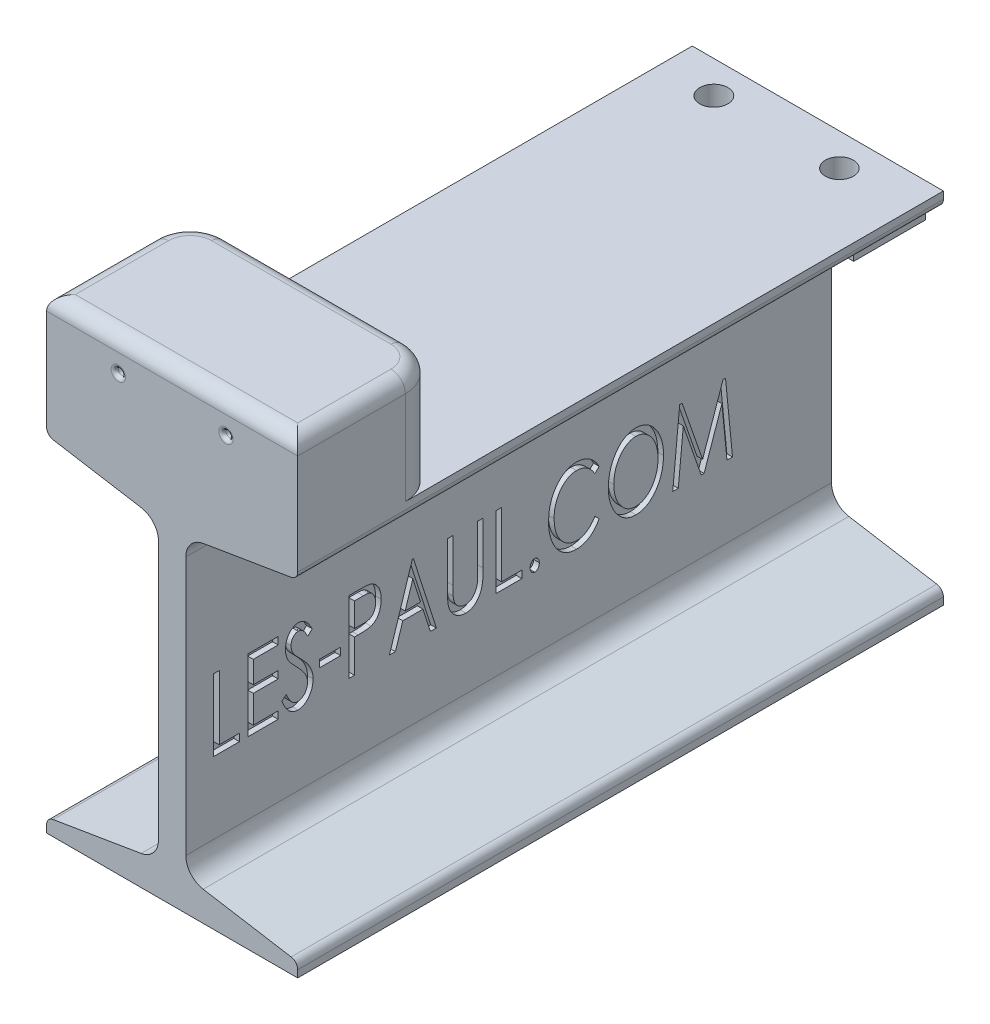
from build123d import *

# Parameters (mm, degrees)
BOSS_EXTRUDE1_DEPTH = 114.3
SKETCH2_W           = 88.9
SKETCH2_H           = 50.8
BOSS_EXTRUDE2_DEPTH = 38.1
FILLET4_R           = 12.7
FILLET5_R           = 5.08
SKETCH42_R          = 1.27
CUT_EXTRUDE3_DEPTH  = 88.9
FILLET8_R           = 1.27
SKETCH45_W          = 76.2
SKETCH45_H          = 25.4
BOSS_EXTRUDE3_DEPTH = 12.065
SKETCH47_R          = 5
CUT_EXTRUDE5_DEPTH  = 12.065
SKETCH47_4_R        = 5
SKETCH47_4_R_2      = 4.953
CUT_EXTRUDE9_DEPTH  = 25.4
SKETCH51_W          = 7.48974359
SKETCH51_H          = 2.605128205
CUT_EXTRUDE8_DEPTH  = 2
SKETCH52_R          = 1.905
CUT_EXTRUDE10_DEPTH = 8.89
SKETCH53_R          = 1.905
CUT_EXTRUDE11_DEPTH = 8.89


with BuildPart() as part:
    # Sketch1 → Boss-Extrude1 (new, symmetric)
    with BuildSketch(Plane.XY):
        with BuildLine():
            Line((-44.45, 63.5), (44.45, 63.5))
            Line((44.45, 63.5), (44.45, 60.96))
            ThreePointArc((44.45, 60.96), (43.787841232, 59.153985338), (42.11521907, 58.203996762))
            Line((42.11521907, 58.203996762), (10.981331544, 53.016312413))
            ThreePointArc((10.981331544, 53.016312413), (6.571691296, 50.511797077), (4.826, 45.750485695))
            Line((4.826, 45.750485695), (4.826, -45.750485695))
            ThreePointArc((4.826, -45.750485695), (6.571691296, -50.511797077), (10.981331544, -53.016312413))
            Line((10.981331544, -53.016312413), (42.11521907, -58.203996762))
            ThreePointArc((42.11521907, -58.203996762), (43.787841232, -59.153985338), (44.45, -60.96))
            Line((44.45, -60.96), (44.45, -63.5))
            Line((44.45, -63.5), (-44.45, -63.5))
            Line((-44.45, -63.5), (-44.45, -60.96))
            ThreePointArc((-44.45, -60.96), (-43.787841232, -59.153985338), (-42.11521907, -58.203996762))
            Line((-42.11521907, -58.203996762), (-10.981331544, -53.016312413))
            ThreePointArc((-10.981331544, -53.016312413), (-6.571691296, -50.511797077), (-4.826, -45.750485695))
            Line((-4.826, -45.750485695), (-4.826, 45.750485695))
            ThreePointArc((-4.826, 45.750485695), (-6.571691296, 50.511797077), (-10.981331544, 53.016312413))
            Line((-10.981331544, 53.016312413), (-42.11521907, 58.203996762))
            ThreePointArc((-42.11521907, 58.203996762), (-43.787841232, 59.153985338), (-44.45, 60.96))
            Line((-44.45, 60.96), (-44.45, 63.5))
        make_face()
    extrude(amount=BOSS_EXTRUDE1_DEPTH, both=True)

    # Sketch2 → Boss-Extrude2 (add)
    with BuildSketch(Plane(origin=(0, 63.5, 0), x_dir=(1, 0, 0), z_dir=(0, 1, 0))):
        with Locations((0, -88.9)):
            Rectangle(SKETCH2_W, SKETCH2_H)
    extrude(amount=BOSS_EXTRUDE2_DEPTH)

    # Fillet4
    fillet4_edges = [part.edges().sort_by_distance(p)[0] for p in [
        (44.45, 82.55, 63.5),
        (-44.45, 82.55, 63.5),
    ]]
    fillet(fillet4_edges, radius=FILLET4_R)

    # Fillet5
    fillet5_edges = [part.edges().sort_by_distance(p)[0] for p in [
        (0, 101.6, 114.3),
        (44.45, 101.6, 95.25),
        (-44.45, 101.6, 95.25),
        (0, 101.6, 63.5),
        (40.730256121, 101.6, 67.219743879),
        (-40.730256121, 101.6, 67.219743879),
    ]]
    fillet(fillet5_edges, radius=FILLET5_R)

    # Sketch42 → Cut-Extrude3 (cut, symmetric)
    with BuildSketch(Plane(origin=(0, 141.271299333, 63.5), x_dir=(-1, 0, 0), z_dir=(0, 0, 1))):
        with Locations(Location((19.05, 51.101299333, 0), (0, 0, 180))):
            Circle(SKETCH42_R)
        with Locations(Location((-19.05, 51.101299333, 0), (0, 0, 180))):
            Circle(SKETCH42_R)
    extrude(amount=CUT_EXTRUDE3_DEPTH, both=True, mode=Mode.SUBTRACT)

    # Fillet8
    fillet8_edges = [part.edges().sort_by_distance(p)[0] for p in [
        (-20.32, 90.17, 114.3),
        (17.78, 90.17, 114.3),
    ]]
    fillet(fillet8_edges, radius=FILLET8_R)

    # Sketch45 → Boss-Extrude3 (add)
    with BuildSketch(Plane(origin=(0, 63.5, 0), x_dir=(1, 0, 0), z_dir=(0, 1, 0))):
        with Locations((0, 101.6)):
            Rectangle(SKETCH45_W, SKETCH45_H)
    extrude(amount=-BOSS_EXTRUDE3_DEPTH)

    # Sketch47 → Cut-Extrude5 (cut)
    with BuildSketch(Plane(origin=(0, 63.5, 0), x_dir=(1, 0, 0), z_dir=(0, 1, 0))):
        with Locations(Location((-25.4, 102.87, 0), (0, 0, 270))):
            Circle(SKETCH47_R)
    extrude(amount=-CUT_EXTRUDE5_DEPTH, mode=Mode.SUBTRACT)

    # Sketch47<4> → Cut-Extrude9 (cut)
    with BuildSketch(Plane(origin=(0, 63.5, 0), x_dir=(1, 0, 0), z_dir=(0, 1, 0))):
        with Locations(Location((-25.4, 102.87, 0), (0, 0, 270))):
            Circle(SKETCH47_4_R)
        with Locations(Location((19.05, 102.87, 0), (0, 0, 270))):
            Circle(SKETCH47_4_R_2)
    extrude(amount=-CUT_EXTRUDE9_DEPTH, mode=Mode.SUBTRACT)

    # Sketch51 → Cut-Extrude8 (cut)
    # profile 1 of 12: a face of its own
    with BuildSketch(Plane(origin=(4.826, 0, 0), x_dir=(0, 0, -1), z_dir=(1, 0, 0))):
        Polygon((-104.400512821, 5.049514305), (-102.446666667, 5.049514305), (-102.446666667, -17.74535749), (-95.282564103, -17.74535749), (-95.282564103, -20.350485695), (-104.400512821, -20.350485695), align=None)
    # profile 2 of 12: a face of its own
    with BuildSketch(Plane(origin=(4.826, 0, 0), x_dir=(0, 0, -1), z_dir=(1, 0, 0))):
        Polygon((-92.351794872, 5.049514305), (-81.605641026, 5.049514305), (-81.605641026, 2.444386099), (-90.397948718, 2.444386099), (-90.397948718, -5.370998516), (-81.605641026, -5.370998516), (-81.605641026, -7.976126721), (-90.397948718, -7.976126721), (-90.397948718, -17.74535749), (-81.605641026, -17.74535749), (-81.605641026, -20.350485695), (-92.351794872, -20.350485695), align=None)
    # profile 3 of 12: a face of its own
    with BuildSketch(Plane(origin=(4.826, 0, 0), x_dir=(0, 0, -1), z_dir=(1, 0, 0))):
        with BuildLine():
            Line((-80.303076923, -15.450605888), (-78.715576923, -14.163306208))
            add(Edge.make_bspline(
                [(-78.715576923, -14.163306208), (-78.574883617, -14.496433349), (-78.307790261, -15.128844713), (-77.848672791, -15.991031141), (-77.378359146, -16.725351333), (-76.890233935, -17.328288444), (-76.384195686, -17.804340451), (-75.85371575, -18.142323844), (-75.302010403, -18.357564561), (-74.923304676, -18.383738902), (-74.736650641, -18.396639542)],
                knots=[0, 0, 0, 0, 1.414329296, 2.684974627, 3.816993744, 4.82134896, 5.71371991, 6.521980361, 7.271523217, 8, 8, 8, 8], degree=3))
            add(Edge.make_bspline(
                [(-74.736650641, -18.396639542), (-74.576468371, -18.390537748), (-74.258840481, -18.378438407), (-73.793054903, -18.257490271), (-73.340345311, -18.0751798), (-72.912086788, -17.812424708), (-72.508521276, -17.497580365), (-72.163797993, -17.113149287), (-71.857485983, -16.690314469), (-71.617890012, -16.213746414), (-71.424733171, -15.708929022), (-71.290284342, -15.182736725), (-71.196220604, -14.643254704), (-71.188856966, -14.277354762), (-71.185128205, -14.092072234)],
                knots=[0, 0, 0, 0, 0.928606423, 1.841347975, 2.778019208, 3.754562154, 4.750003874, 5.740068751, 6.74327989, 7.774305638, 8.828187407, 9.877177034, 10.925055835, 12, 12, 12, 12], degree=3))
            add(Edge.make_bspline(
                [(-71.185128205, -14.092072234), (-71.193674346, -13.881298182), (-71.210894362, -13.456599726), (-71.329186502, -12.824261314), (-71.536991306, -12.200441646), (-71.7284779, -11.802193381), (-71.826233974, -11.598883131)],
                knots=[0, 0, 0, 0, 0.973184621, 1.960915033, 2.959024035, 4, 4, 4, 4], degree=3))
            add(Edge.make_bspline(
                [(-71.826233974, -11.598883131), (-71.905987395, -11.453745961), (-72.072088808, -11.151470663), (-72.365014851, -10.699407637), (-72.703227769, -10.225743541), (-73.082307628, -9.727923138), (-73.514212659, -9.213847701), (-73.986064705, -8.67474508), (-74.50542128, -8.114957594), (-74.873060772, -7.741135876), (-75.062291667, -7.548722875)],
                knots=[0, 0, 0, 0, 0.763930207, 1.591027513, 2.483480193, 3.449232408, 4.477278696, 5.580830734, 6.75480852, 8, 8, 8, 8], degree=3))
            add(Edge.make_bspline(
                [(-75.062291667, -7.548722875), (-75.25189093, -7.358349557), (-75.615101585, -6.993656065), (-76.114764574, -6.450539225), (-76.571044501, -5.961384157), (-76.963046142, -5.50541873), (-77.302697139, -5.095265609), (-77.593123878, -4.730360526), (-77.816296476, -4.39919465), (-77.941286482, -4.189343936), (-77.998149038, -4.093875118)],
                knots=[0, 0, 0, 0, 1.418850322, 2.718056736, 3.897251478, 4.951422659, 5.8930247, 6.710073348, 7.413164863, 8, 8, 8, 8], degree=3))
            add(Edge.make_bspline(
                [(-77.998149038, -4.093875118), (-78.152440258, -3.793914077), (-78.459797177, -3.196374555), (-78.769602487, -2.237298794), (-78.968261992, -1.244297894), (-78.989675656, -0.568765651), (-79.000512821, -0.226887939)],
                knots=[0, 0, 0, 0, 1.001108881, 1.994266056, 2.984925235, 4, 4, 4, 4], degree=3))
            add(Edge.make_bspline(
                [(-79.000512821, -0.226887939), (-78.994305521, 0.041496069), (-78.982070331, 0.570507014), (-78.866540242, 1.344372237), (-78.683628239, 2.082613124), (-78.431597929, 2.778052601), (-78.111011709, 3.420077948), (-77.733048162, 4.000243636), (-77.281030927, 4.497518939), (-76.786237033, 4.928531811), (-76.241173941, 5.265998963), (-75.672646448, 5.524795485), (-75.072713582, 5.668738171), (-74.66611162, 5.690078118), (-74.461891026, 5.700796356)],
                knots=[0, 0, 0, 0, 1.164897853, 2.296126809, 3.389408097, 4.463591626, 5.501192921, 6.500141296, 7.459869412, 8.410567131, 9.340436335, 10.234129343, 11.113070797, 12, 12, 12, 12], degree=3))
            add(Edge.make_bspline(
                [(-74.461891026, 5.700796356), (-74.243669026, 5.690417405), (-73.807046608, 5.669651019), (-73.16679994, 5.487783195), (-72.554594587, 5.190244396), (-72.066474848, 4.855743598), (-71.687451483, 4.520671185), (-71.390353168, 4.22049364), (-71.098610553, 3.864313062), (-70.790224847, 3.469964893), (-70.488913429, 3.019190023), (-70.175643019, 2.526339413), (-69.868642719, 1.979242308), (-69.663201287, 1.598355935), (-69.556923077, 1.401317189)],
                knots=[0, 0, 0, 0, 1.140380209, 2.281692792, 3.452920377, 4.691375479, 5.364411118, 6.098804295, 6.898921468, 7.772434317, 8.717854819, 9.734979681, 10.828267973, 12, 12, 12, 12], degree=3))
            Line((-69.556923077, 1.401317189), (-71.083365385, -0.160742106))
            add(Edge.make_bspline(
                [(-71.083365385, -0.160742106), (-71.168930099, -0.000795523), (-71.332993353, 0.305888801), (-71.584061842, 0.739264255), (-71.820916916, 1.13099335), (-72.05094068, 1.478357018), (-72.269429838, 1.784187514), (-72.477206685, 2.051494102), (-72.678614357, 2.273670301), (-72.927821762, 2.510573967), (-73.240715575, 2.74512807), (-73.639017921, 2.949431668), (-74.057957136, 3.071007308), (-74.34410618, 3.087442087), (-74.487331731, 3.095668151)],
                knots=[0, 0, 0, 0, 1.317128241, 2.525484315, 3.636527255, 4.64079651, 5.549935754, 6.365497412, 7.097863337, 7.725136904, 8.860688858, 9.923730158, 10.960769228, 12, 12, 12, 12], degree=3))
            add(Edge.make_bspline(
                [(-74.487331731, 3.095668151), (-74.66877358, 3.08647948), (-75.024186363, 3.068480486), (-75.525353653, 2.879242124), (-75.971187528, 2.578372594), (-76.352332198, 2.170810679), (-76.661269865, 1.680842351), (-76.88786195, 1.128659851), (-77.021007222, 0.520540979), (-77.037943899, 0.097723497), (-77.046666667, -0.120036977)],
                knots=[0, 0, 0, 0, 0.947262136, 1.855520515, 2.76521309, 3.746036188, 4.757045497, 5.785411126, 6.859437121, 8, 8, 8, 8], degree=3))
            add(Edge.make_bspline(
                [(-77.046666667, -0.120036977), (-77.033080223, -0.390714519), (-77.005922293, -0.93177164), (-76.843629942, -1.599403645), (-76.642627053, -2.129342179), (-76.428746008, -2.539066923), (-76.174599595, -2.971704269), (-75.972083393, -3.25420864), (-75.866217949, -3.401887939)],
                knots=[0, 0, 0, 0, 1.37118372, 2.740858038, 3.459154736, 4.239466331, 5.07968016, 6, 6, 6, 6], degree=3))
            add(Edge.make_bspline(
                [(-75.866217949, -3.401887939), (-75.827835439, -3.451600508), (-75.736576788, -3.569797627), (-75.560941685, -3.758140072), (-75.340211291, -4.003503553), (-75.062080868, -4.292129336), (-74.73700842, -4.63684926), (-74.352902659, -5.021190357), (-73.921179917, -5.459513004), (-73.615645978, -5.767953556), (-73.454439103, -5.930694029)],
                knots=[0, 0, 0, 0, 0.430988114, 1.024721792, 1.76647773, 2.697202889, 3.776087901, 5.019389473, 6.42735995, 8, 8, 8, 8], degree=3))
            add(Edge.make_bspline(
                [(-73.454439103, -5.930694029), (-73.260089637, -6.131578371), (-72.882087045, -6.522291058), (-72.346688869, -7.108486753), (-71.85668176, -7.67626187), (-71.420196394, -8.232054599), (-71.025925928, -8.766747429), (-70.678124786, -9.284447064), (-70.382162152, -9.78984777), (-70.053120761, -10.432908519), (-69.729533391, -11.231594932), (-69.438239942, -12.192390034), (-69.264617012, -13.159729922), (-69.242344243, -13.806472362), (-69.231282051, -14.127689221)],
                knots=[0, 0, 0, 0, 1.061650765, 2.064871852, 3.015192632, 3.909651769, 4.748487401, 5.538240563, 6.277422274, 6.971787199, 8.280588746, 9.544330434, 10.780345287, 12, 12, 12, 12], degree=3))
            add(Edge.make_bspline(
                [(-69.231282051, -14.127689221), (-69.236519066, -14.355134053), (-69.24686259, -14.804355837), (-69.318372907, -15.466447204), (-69.440192426, -16.10655258), (-69.61533976, -16.723270673), (-69.831914738, -17.320720737), (-70.103967282, -17.891392682), (-70.421218347, -18.439920118), (-70.782908222, -18.958188131), (-71.181645769, -19.433020967), (-71.603277765, -19.853472645), (-72.048074267, -20.207887604), (-72.516129622, -20.496855874), (-73.005716667, -20.72006243), (-73.515145392, -20.886632907), (-74.047579911, -20.98566503), (-74.4105984, -20.996359421), (-74.594182692, -21.001767747)],
                knots=[0, 0, 0, 0, 1.131232867, 2.234275627, 3.308057344, 4.368366236, 5.419947047, 6.465248897, 7.508506211, 8.568680852, 9.604544426, 10.588832032, 11.525588353, 12.426995702, 13.317880349, 14.195606517, 15.087489175, 16, 16, 16, 16], degree=3))
            add(Edge.make_bspline(
                [(-74.594182692, -21.001767747), (-74.736927008, -20.998188552), (-75.018662454, -20.99112427), (-75.435138458, -20.924549855), (-75.844486996, -20.832406731), (-76.240788092, -20.685131701), (-76.629712613, -20.509631519), (-77.003879286, -20.285724321), (-77.370555567, -20.026606371), (-77.728699096, -19.724355887), (-78.078039857, -19.374163986), (-78.417305558, -18.971863689), (-78.749091709, -18.515289114), (-79.072739215, -18.005828318), (-79.394201492, -17.444135858), (-79.70824748, -16.829511568), (-80.014319473, -16.160138837), (-80.204760855, -15.692187499), (-80.303076923, -15.450605888)],
                knots=[0, 0, 0, 0, 0.80641686, 1.591630553, 2.380116471, 3.174817209, 3.977175809, 4.789613756, 5.635706132, 6.513588636, 7.435761596, 8.429079662, 9.48590961, 10.624418481, 11.839996669, 13.143758314, 14.525454655, 16, 16, 16, 16], degree=3))
        make_face()
    # profile 4 of 12: a face of its own
    with BuildSketch(Plane(origin=(4.826, 0, 0), x_dir=(0, 0, -1), z_dir=(1, 0, 0))):
        with Locations((-63.206923077, -10.581254927)):
            Rectangle(SKETCH51_W, SKETCH51_H)
    # profile 5 of 12: a face of its own
    with BuildSketch(Plane(origin=(4.826, 0, 0), x_dir=(0, 0, -1), z_dir=(1, 0, 0))):
        with BuildLine():
            Line((-56.531282051, 5.049514305), (-52.898349359, 5.049514305))
            add(Edge.make_bspline(
                [(-52.898349359, 5.049514305), (-52.649010304, 5.049127554), (-52.170591209, 5.048385477), (-51.485311202, 5.026598822), (-50.862648149, 4.997311822), (-50.302851098, 4.95638716), (-49.80483673, 4.909355055), (-49.372443176, 4.841696449), (-49.001690845, 4.770874621), (-48.78154173, 4.700345007), (-48.680280449, 4.667903728)],
                knots=[0, 0, 0, 0, 1.408102797, 2.701796009, 3.8718109, 4.928251744, 5.871839663, 6.695497245, 7.399972055, 8, 8, 8, 8], degree=3))
            add(Edge.make_bspline(
                [(-48.680280449, 4.667903728), (-48.552015626, 4.619489914), (-48.295211071, 4.522558522), (-47.928952703, 4.332547841), (-47.581014099, 4.108071771), (-47.253706927, 3.845520441), (-46.942665308, 3.548980817), (-46.647057106, 3.218143743), (-46.371717984, 2.850158489), (-46.119477474, 2.447177817), (-45.883247624, 2.018502798), (-45.686874401, 1.554786194), (-45.512275649, 1.070077508), (-45.376565832, 0.553444781), (-45.263270829, 0.013938558), (-45.189048837, -0.555947186), (-45.142117935, -1.15043114), (-45.136639204, -1.556495486), (-45.133846154, -1.763506529)],
                knots=[0, 0, 0, 0, 0.839177315, 1.680153236, 2.521578208, 3.371744001, 4.246190825, 5.151205776, 6.086193668, 7.057472754, 8.061533904, 9.080532497, 10.138554578, 11.214630961, 12.349480532, 13.513113772, 14.732188835, 16, 16, 16, 16], degree=3))
            add(Edge.make_bspline(
                [(-45.133846154, -1.763506529), (-45.136423039, -1.972237292), (-45.141457617, -2.38004418), (-45.191116525, -2.977368426), (-45.256532579, -3.547823137), (-45.368349611, -4.088343611), (-45.49496568, -4.604263588), (-45.667577355, -5.088122819), (-45.857605826, -5.54782307), (-46.082766424, -5.975678602), (-46.332995003, -6.372297697), (-46.600873169, -6.741611214), (-46.897649176, -7.071856432), (-47.213815104, -7.371041177), (-47.55773514, -7.629204014), (-47.919543148, -7.861569976), (-48.307996904, -8.054695776), (-48.579300656, -8.158112609), (-48.715897436, -8.210181208)],
                knots=[0, 0, 0, 0, 1.268727272, 2.478770805, 3.642679035, 4.756972709, 5.832418661, 6.86945864, 7.876852363, 8.854679698, 9.804540462, 10.726451323, 11.624761461, 12.500231754, 13.368506446, 14.235310315, 15.111509054, 16, 16, 16, 16], degree=3))
            add(Edge.make_bspline(
                [(-48.715897436, -8.210181208), (-48.82913221, -8.243939831), (-49.07534797, -8.317344004), (-49.483687297, -8.401072413), (-49.95596725, -8.470900541), (-50.496043926, -8.525366709), (-51.101804604, -8.569661071), (-51.775192385, -8.606051548), (-52.51322552, -8.625824368), (-53.027237781, -8.626865806), (-53.295224359, -8.627408772)],
                knots=[0, 0, 0, 0, 0.614511515, 1.336183347, 2.166049544, 3.097626369, 4.159464783, 5.325852385, 6.60580044, 8, 8, 8, 8], degree=3))
            Line((-53.295224359, -8.627408772), (-54.577435897, -8.627408772))
            Line((-54.577435897, -8.627408772), (-54.577435897, -20.350485695))
            Line((-54.577435897, -20.350485695), (-56.531282051, -20.350485695))
            Line((-56.531282051, -20.350485695), (-56.531282051, 5.049514305))
        make_face()
        with BuildLine():
            Line((-54.577435897, 2.444386099), (-54.577435897, -6.022280567))
            Line((-54.577435897, -6.022280567), (-51.570344551, -6.078250118))
            add(Edge.make_bspline(
                [(-51.570344551, -6.078250118), (-51.286835731, -6.07287522), (-50.75732528, -6.062836501), (-50.02432771, -5.978938482), (-49.408784403, -5.844701497), (-48.902832856, -5.636755027), (-48.486281899, -5.355830012), (-48.12896026, -5.005818034), (-47.819613843, -4.585188594), (-47.556903748, -4.099998762), (-47.344961094, -3.567366829), (-47.199301739, -2.994111282), (-47.104239547, -2.394219645), (-47.093265093, -1.982667415), (-47.087692308, -1.773682811)],
                knots=[0, 0, 0, 0, 1.421690097, 2.655295746, 3.695350748, 4.572296678, 5.381639719, 6.199876907, 7.069362859, 7.990742985, 8.9607615, 9.936805262, 10.952317826, 12, 12, 12, 12], degree=3))
            add(Edge.make_bspline(
                [(-47.087692308, -1.773682811), (-47.093294555, -1.569771147), (-47.104370282, -1.166634755), (-47.200069973, -0.577127952), (-47.34436422, -0.010121912), (-47.559264266, 0.516679765), (-47.811539713, 0.999318299), (-48.115349707, 1.412647557), (-48.45590874, 1.753512646), (-48.852959605, 2.022896919), (-49.33464404, 2.221342853), (-49.92646237, 2.348278921), (-50.639986668, 2.436475154), (-51.157863687, 2.441608684), (-51.438052885, 2.444386099)],
                knots=[0, 0, 0, 0, 1.047894732, 2.071703465, 3.063855298, 4.050163204, 4.990556187, 5.857507423, 6.677751568, 7.456660696, 8.308699621, 9.338951891, 10.560281869, 12, 12, 12, 12], degree=3))
            Line((-51.438052885, 2.444386099), (-54.577435897, 2.444386099))
        make_face(mode=Mode.SUBTRACT)
    # profile 6 of 12: a face of its own
    with BuildSketch(Plane(origin=(4.826, 0, 0), x_dir=(0, 0, -1), z_dir=(1, 0, 0))):
        Polygon((-33.736410256, 5.049514305), (-25.595384615, -20.350485695), (-27.722227564, -20.350485695), (-30.33244391, -12.209460054), (-37.466017628, -12.209460054), (-40.076233974, -20.350485695), (-42.203076923, -20.350485695), (-34.062051282, 5.049514305), align=None)
        Polygon((-33.90431891, -1.07660749), (-36.6315625, -9.604331849), (-31.166899038, -9.604331849), align=None, mode=Mode.SUBTRACT)
    # profile 7 of 12: a face of its own
    with BuildSketch(Plane(origin=(4.826, 0, 0), x_dir=(0, 0, -1), z_dir=(1, 0, 0))):
        with BuildLine():
            Line((-21.687692308, 5.049514305), (-19.733846154, 5.049514305))
            Line((-19.733846154, 5.049514305), (-19.733846154, -10.169115503))
            add(Edge.make_bspline(
                [(-19.733846154, -10.169115503), (-19.734419854, -10.384516578), (-19.73550855, -10.793277238), (-19.728236791, -11.374997759), (-19.725702189, -11.89235871), (-19.714004206, -12.346852391), (-19.704025682, -12.736958287), (-19.694984171, -13.064383663), (-19.682065003, -13.327637009), (-19.66489684, -13.481545667), (-19.657524038, -13.547641144)],
                knots=[0, 0, 0, 0, 1.529245249, 2.902006395, 4.13027814, 5.202224501, 6.1297174, 6.900736874, 7.527925705, 8, 8, 8, 8], degree=3))
            add(Edge.make_bspline(
                [(-19.657524038, -13.547641144), (-19.628500308, -13.785528724), (-19.572401982, -14.245328173), (-19.439416747, -14.902992696), (-19.247868487, -15.498207989), (-19.017901644, -16.041506813), (-18.713443662, -16.528228893), (-18.352378106, -16.976137824), (-17.910560553, -17.374210295), (-17.416863421, -17.729748591), (-16.884655689, -18.020840242), (-16.342600981, -18.238509636), (-15.795470228, -18.373915672), (-15.428316153, -18.389102605), (-15.246105769, -18.396639542)],
                knots=[0, 0, 0, 0, 1.193552583, 2.30695028, 3.335553219, 4.303975153, 5.237079741, 6.185733983, 7.160326611, 8.189519136, 9.210286644, 10.17349909, 11.093548312, 12, 12, 12, 12], degree=3))
            add(Edge.make_bspline(
                [(-15.246105769, -18.396639542), (-15.08962082, -18.389043265), (-14.77878863, -18.373954482), (-14.316590866, -18.274558358), (-13.869052874, -18.102389717), (-13.428355626, -17.875103887), (-13.017408151, -17.578544882), (-12.628794838, -17.238033747), (-12.290631999, -16.8342915), (-11.977105905, -16.390448523), (-11.700348353, -15.893297698), (-11.471044736, -15.34409019), (-11.272560598, -14.747796334), (-11.181788637, -14.328876041), (-11.134887821, -14.112424798)],
                knots=[0, 0, 0, 0, 0.874993045, 1.738032991, 2.629319637, 3.54979419, 4.502296025, 5.456024522, 6.431154259, 7.438805526, 8.491631882, 9.604869551, 10.762463955, 12, 12, 12, 12], degree=3))
            add(Edge.make_bspline(
                [(-11.134887821, -14.112424798), (-11.118829001, -14.022660899), (-11.082910338, -13.821886536), (-11.043103257, -13.485669778), (-11.017354938, -13.08635569), (-10.982523165, -12.625430568), (-10.966224461, -12.100974039), (-10.94844737, -11.512501877), (-10.947256666, -10.861088123), (-10.943500587, -10.406556715), (-10.941538462, -10.169115503)],
                knots=[0, 0, 0, 0, 0.553647831, 1.238340717, 2.054285454, 2.983230775, 4.04480203, 5.239856939, 6.55813767, 8, 8, 8, 8], degree=3))
            Line((-10.941538462, -10.169115503), (-10.941538462, 5.049514305))
            Line((-10.941538462, 5.049514305), (-8.987692308, 5.049514305))
            Line((-8.987692308, 5.049514305), (-8.987692308, -10.291230888))
            add(Edge.make_bspline(
                [(-8.987692308, -10.291230888), (-8.990533503, -10.567689397), (-8.996077146, -11.107105631), (-9.013427966, -11.897839266), (-9.055248583, -12.647631356), (-9.110508473, -13.356854675), (-9.18120725, -14.023757316), (-9.267674915, -14.651616557), (-9.368044959, -15.239108412), (-9.52083616, -15.961557271), (-9.776619791, -16.81273591), (-10.218639971, -17.768322022), (-10.79046292, -18.655096676), (-11.360184996, -19.331391117), (-11.873854095, -19.814309761), (-12.282598124, -20.131452442), (-12.709738156, -20.401659521), (-13.157032622, -20.625112237), (-13.626448525, -20.789923549), (-14.114452866, -20.915562923), (-14.623304788, -20.985867639), (-14.96945034, -20.996430688), (-15.144342949, -21.001767747)],
                knots=[0, 0, 0, 0, 1.199153125, 2.339745895, 3.430054927, 4.45576547, 5.424916991, 6.338332477, 7.204243538, 8.009337379, 9.540455156, 11.047886808, 12.559942218, 14.10467708, 14.869758693, 15.614300579, 16.344939654, 17.05883359, 17.777825889, 18.498622249, 19.241417747, 20, 20, 20, 20], degree=3))
            add(Edge.make_bspline(
                [(-15.144342949, -21.001767747), (-15.334444779, -20.996045068), (-15.708998608, -20.984769788), (-16.261665501, -20.920457578), (-16.789998131, -20.800724473), (-17.30120776, -20.644562733), (-17.787408934, -20.432366142), (-18.26038219, -20.186471825), (-18.702238532, -19.879117375), (-19.130351055, -19.542682642), (-19.525278722, -19.160658417), (-19.887265534, -18.745553018), (-20.220658136, -18.304732909), (-20.508203878, -17.827370218), (-20.770980402, -17.325568616), (-20.999288128, -16.793878471), (-21.18794843, -16.229645739), (-21.286497992, -15.841385898), (-21.336610577, -15.643955247)],
                knots=[0, 0, 0, 0, 1.02691336, 2.023306831, 2.998938055, 3.949170674, 4.905344643, 5.860113636, 6.822976816, 7.807170128, 8.798329162, 9.784949064, 10.779699189, 11.778825563, 12.7907599, 13.837138133, 14.900181831, 16, 16, 16, 16], degree=3))
            add(Edge.make_bspline(
                [(-21.336610577, -15.643955247), (-21.3651897, -15.508533148), (-21.427406906, -15.213717078), (-21.495101418, -14.729190151), (-21.554953912, -14.170876531), (-21.607119698, -13.538155706), (-21.63776502, -12.83201936), (-21.672113064, -12.0520219), (-21.684450758, -11.196956491), (-21.68658149, -10.60160589), (-21.687692308, -10.291230888)],
                knots=[0, 0, 0, 0, 0.618069528, 1.345547232, 2.18383347, 3.126287198, 4.180663136, 5.340657274, 6.613600957, 8, 8, 8, 8], degree=3))
            Line((-21.687692308, -10.291230888), (-21.687692308, 5.049514305))
        make_face()
    # profile 8 of 12: a face of its own
    with BuildSketch(Plane(origin=(4.826, 0, 0), x_dir=(0, 0, -1), z_dir=(1, 0, 0))):
        Polygon((-4.428717949, 5.049514305), (-2.474871795, 5.049514305), (-2.474871795, -17.74535749), (4.689230769, -17.74535749), (4.689230769, -20.350485695), (-4.428717949, -20.350485695), align=None)
    # profile 9 of 12: a face of its own
    with BuildSketch(Plane(origin=(4.826, 0, 0), x_dir=(0, 0, -1), z_dir=(1, 0, 0))):
        with BuildLine():
            add(Edge.make_bspline(
                [(9.248205128, -16.442793388), (9.357685185, -16.45117466), (9.574048565, -16.467738411), (9.885896937, -16.585144278), (10.164862871, -16.786744107), (10.410783294, -17.057131819), (10.615586159, -17.379584969), (10.773485392, -17.740423245), (10.858613205, -18.140026264), (10.870349325, -18.416618454), (10.876410256, -18.559460054)],
                knots=[0, 0, 0, 0, 0.888235515, 1.755403159, 2.664739847, 3.658771767, 4.705496901, 5.754303631, 6.840246125, 8, 8, 8, 8], degree=3))
            add(Edge.make_bspline(
                [(10.876410256, -18.559460054), (10.870120689, -18.698878826), (10.857798962, -18.972010482), (10.773741068, -19.368467348), (10.614115424, -19.72994497), (10.412429179, -20.055944852), (10.164886383, -20.327492872), (9.884788133, -20.527359019), (9.575215863, -20.652614995), (9.357873824, -20.668241658), (9.248205128, -20.676126721)],
                knots=[0, 0, 0, 0, 1.133833385, 2.221263238, 3.271506465, 4.33130329, 5.326696684, 6.237278843, 7.110547914, 8, 8, 8, 8], degree=3))
            add(Edge.make_bspline(
                [(9.248205128, -20.676126721), (9.138482352, -20.668317699), (8.921033137, -20.652841734), (8.610958156, -20.525920707), (8.326677342, -20.329449327), (8.079481459, -20.05551119), (7.875882643, -19.731263361), (7.724140643, -19.367124251), (7.638181975, -18.972195679), (7.626144482, -18.698941412), (7.62, -18.559460054)],
                knots=[0, 0, 0, 0, 0.888790314, 1.761409654, 2.682617918, 3.677270718, 4.73627903, 5.78038943, 6.867010211, 8, 8, 8, 8], degree=3))
            add(Edge.make_bspline(
                [(7.62, -18.559460054), (7.625910501, -18.416553565), (7.637355336, -18.139835727), (7.724396655, -17.741766412), (7.874436941, -17.378278185), (8.081123528, -17.057561776), (8.326698585, -16.784787628), (8.609836957, -16.586554169), (8.922199845, -16.467509752), (9.138670692, -16.451097833), (9.248205128, -16.442793388)],
                knots=[0, 0, 0, 0, 1.158892172, 2.244027806, 3.286711158, 4.33265857, 5.32595192, 6.245901114, 7.112424448, 8, 8, 8, 8], degree=3))
        make_face()
    # profile 10 of 12: a face of its own
    with BuildSketch(Plane(origin=(4.826, 0, 0), x_dir=(0, 0, -1), z_dir=(1, 0, 0))):
        with BuildLine():
            Line((32.043076923, 0.388777125), (30.567516026, -1.137665183))
            add(Edge.make_bspline(
                [(30.567516026, -1.137665183), (30.365599146, -0.80756093), (29.973387366, -0.166352643), (29.289404565, 0.696909986), (28.534807974, 1.424690638), (27.727701589, 2.030796204), (26.869652313, 2.509799174), (25.962076402, 2.847381147), (25.014302572, 3.059851564), (24.366179375, 3.083663483), (24.03943109, 3.095668151)],
                knots=[0, 0, 0, 0, 1.135693638, 2.206018759, 3.223992528, 4.206184903, 5.162592443, 6.098801558, 7.041519676, 8, 8, 8, 8], degree=3))
            add(Edge.make_bspline(
                [(24.03943109, 3.095668151), (23.859381578, 3.092656319), (23.499530748, 3.086636808), (22.967368351, 3.010199005), (22.44419207, 2.900246368), (21.932166349, 2.740122239), (21.43060983, 2.536862782), (20.935877473, 2.290688618), (20.456036098, 1.995283753), (19.986577396, 1.658773597), (19.537166616, 1.283478674), (19.108172471, 0.877651471), (18.711410848, 0.435159739), (18.333029608, -0.030338217), (17.987790284, -0.532392414), (17.664816104, -1.063186423), (17.372898976, -1.627463973), (17.101497705, -2.217201057), (16.864214277, -2.832999668), (16.654244686, -3.467431674), (16.48307755, -4.124432238), (16.333983839, -4.797465832), (16.221854133, -5.490617541), (16.149009463, -6.202633691), (16.0934915, -6.932191906), (16.088955538, -7.426497262), (16.086666667, -7.675926401)],
                knots=[0, 0, 0, 0, 0.872413377, 1.743624148, 2.601810317, 3.462868589, 4.341039258, 5.223781062, 6.13921199, 7.070430216, 8.022373848, 8.976411344, 9.931299268, 10.902343116, 11.883366553, 12.883408275, 13.913437901, 14.962338874, 16.029936028, 17.111882572, 18.201119231, 19.320673536, 20.453740451, 21.603577775, 22.790752465, 24, 24, 24, 24], degree=3))
            add(Edge.make_bspline(
                [(16.086666667, -7.675926401), (16.09312673, -8.051034849), (16.105781912, -8.785867484), (16.216229041, -9.863709261), (16.389472615, -10.894156547), (16.648950759, -11.875644747), (16.96592045, -12.813482556), (17.359258869, -13.705105036), (17.829326137, -14.544290306), (18.359779926, -15.330986027), (18.946503931, -16.045802891), (19.575661765, -16.675828143), (20.248892722, -17.204003087), (20.953774675, -17.641233133), (21.698789794, -17.981978884), (22.483032105, -18.218142388), (23.303922781, -18.374575872), (23.865698891, -18.389201962), (24.151370192, -18.396639542)],
                knots=[0, 0, 0, 0, 1.2059327, 2.362406674, 3.480524526, 4.562612735, 5.623337043, 6.661098003, 7.691437249, 8.712510888, 9.708320492, 10.66089415, 11.569762527, 12.453727026, 13.322622265, 14.195564816, 15.082418534, 16, 16, 16, 16], degree=3))
            add(Edge.make_bspline(
                [(24.151370192, -18.396639542), (24.466227146, -18.384325687), (25.0887927, -18.359977546), (25.999699959, -18.153047395), (26.869205667, -17.820016184), (27.696292964, -17.348169859), (28.484260262, -16.747065947), (29.228757213, -16.010927143), (29.935320498, -15.144986371), (30.351659593, -14.498490449), (30.567516026, -14.163306208)],
                knots=[0, 0, 0, 0, 0.93689583, 1.852520847, 2.767253495, 3.701530616, 4.678576124, 5.71099564, 6.813235843, 8, 8, 8, 8], degree=3))
            Line((30.567516026, -14.163306208), (32.043076923, -15.674484093))
            add(Edge.make_bspline(
                [(32.043076923, -15.674484093), (31.928279739, -15.881010584), (31.700778277, -16.290298311), (31.325270159, -16.87316548), (30.926249659, -17.417584409), (30.51321479, -17.932972787), (30.072467841, -18.406845812), (29.612439519, -18.847360002), (29.132781, -19.252004831), (28.630321206, -19.616185702), (28.111866517, -19.944096928), (27.574723902, -20.223954784), (27.023910946, -20.463848618), (26.458376028, -20.663719749), (25.876358804, -20.817071718), (25.278784812, -20.921648818), (24.666945529, -20.991814844), (24.253331095, -20.998428742), (24.044519231, -21.001767747)],
                knots=[0, 0, 0, 0, 1.120033088, 2.219646473, 3.284367226, 4.319154029, 5.349055599, 6.350017175, 7.337353397, 8.321672642, 9.289931778, 10.243047789, 11.190141157, 12.136175768, 13.084053903, 14.039879559, 15.01043975, 16, 16, 16, 16], degree=3))
            add(Edge.make_bspline(
                [(24.044519231, -21.001767747), (23.847613776, -20.999803698), (23.456364011, -20.995901146), (22.879120272, -20.935248504), (22.315938594, -20.851797997), (21.771404979, -20.726739109), (21.238748279, -20.577698535), (20.726114791, -20.380294858), (20.225720218, -20.159421041), (19.744658149, -19.895690147), (19.276484963, -19.601309818), (18.823004282, -19.271223748), (18.391200477, -18.901922581), (17.971538322, -18.504506078), (17.569419127, -18.070602846), (17.182761871, -17.601295417), (16.809830393, -17.097393117), (16.57996917, -16.740923554), (16.463189103, -16.559820631)],
                knots=[0, 0, 0, 0, 1.025194621, 2.037054553, 3.020434316, 3.989260086, 4.945557148, 5.898952184, 6.848039227, 7.792881249, 8.753738336, 9.727426248, 10.711599443, 11.711470044, 12.736702733, 13.790987993, 14.877720364, 16, 16, 16, 16], degree=3))
            add(Edge.make_bspline(
                [(16.463189103, -16.559820631), (16.27627419, -16.242166507), (15.900316683, -15.603242348), (15.432488669, -14.585795333), (15.025385857, -13.524965966), (14.705531584, -12.411728607), (14.439152091, -11.254688265), (14.269876825, -10.045746303), (14.150207125, -8.790937299), (14.138685626, -7.937419698), (14.132820513, -7.502929606)],
                knots=[0, 0, 0, 0, 0.93320784, 1.87703854, 2.833065133, 3.809300283, 4.808988226, 5.838375245, 6.899607296, 8, 8, 8, 8], degree=3))
            add(Edge.make_bspline(
                [(14.132820513, -7.502929606), (14.141589467, -7.046347891), (14.158806664, -6.149883204), (14.294952637, -4.833994598), (14.509287804, -3.572397878), (14.823670189, -2.369577442), (15.21198823, -1.215613798), (15.703593574, -0.123575767), (16.275469348, 0.918396351), (16.932370598, 1.891514387), (17.651322115, 2.783172241), (18.426795818, 3.564062402), (19.25281889, 4.218535948), (20.115619598, 4.76605291), (21.029310418, 5.187414811), (21.989536999, 5.48187342), (22.992730951, 5.665876389), (23.677383821, 5.689055784), (24.024166667, 5.700796356)],
                knots=[0, 0, 0, 0, 1.195271502, 2.34682787, 3.460228925, 4.542725944, 5.598821008, 6.644472296, 7.67408218, 8.707477688, 9.714544999, 10.669163693, 11.582576715, 12.468500816, 13.338827293, 14.208303603, 15.092489635, 16, 16, 16, 16], degree=3))
            add(Edge.make_bspline(
                [(24.024166667, 5.700796356), (24.234638082, 5.697223633), (24.653250253, 5.690117749), (25.272644638, 5.622903738), (25.877366935, 5.509006911), (26.465902307, 5.357271412), (27.041246716, 5.165045608), (27.595093377, 4.91745162), (28.135816837, 4.632220346), (28.660480788, 4.307063277), (29.163379151, 3.938863217), (29.648103206, 3.538265325), (30.104531089, 3.097279695), (30.546700996, 2.629866203), (30.955607362, 2.11987507), (31.345407454, 1.576926044), (31.711051889, 0.999363428), (31.931698482, 0.593599485), (32.043076923, 0.388777125)],
                knots=[0, 0, 0, 0, 0.996050703, 1.981071612, 2.944758098, 3.906703988, 4.856240635, 5.812440303, 6.774922097, 7.748490416, 8.731283955, 9.723249409, 10.722659482, 11.73373946, 12.766922331, 13.814078862, 14.896586223, 16, 16, 16, 16], degree=3))
        make_face()
    # profile 11 of 12: a face of its own
    with BuildSketch(Plane(origin=(4.826, 0, 0), x_dir=(0, 0, -1), z_dir=(1, 0, 0))):
        with BuildLine():
            add(Edge.make_bspline(
                [(44.946602564, 5.700796356), (45.291614187, 5.68887377), (45.971080431, 5.665393418), (46.969763854, 5.484499457), (47.920366967, 5.173072776), (48.836226709, 4.757116187), (49.698622399, 4.204337883), (50.519011112, 3.53639389), (51.294213608, 2.745987933), (52.018379691, 1.845829141), (52.679457006, 0.862124893), (53.258774379, -0.188238529), (53.745369137, -1.294441702), (54.151237682, -2.455362465), (54.459688317, -3.673100149), (54.676629273, -4.947506169), (54.81159312, -6.275476793), (54.829066804, -7.180356814), (54.837948718, -7.640309413)],
                knots=[0, 0, 0, 0, 0.898098036, 1.768715194, 2.63185109, 3.497379012, 4.380773147, 5.291241178, 6.24686274, 7.258020093, 8.295511944, 9.329312446, 10.37727006, 11.438773534, 12.52813492, 13.64410021, 14.802490707, 16, 16, 16, 16], degree=3))
            add(Edge.make_bspline(
                [(54.837948718, -7.640309413), (54.829097108, -8.096877511), (54.811684899, -8.995003276), (54.676159649, -10.314418734), (54.459946723, -11.582192844), (54.149642932, -12.797655249), (53.745702696, -13.958363429), (53.26220502, -15.070064986), (52.686173865, -16.126622287), (52.023175386, -17.114549345), (51.305018396, -18.020095341), (50.537778617, -18.815688482), (49.733881399, -19.4951073), (48.880326886, -20.043062725), (47.992330094, -20.477455272), (47.059730262, -20.77639654), (46.092499221, -20.968045054), (45.432576696, -20.990450602), (45.099246795, -21.001767747)],
                knots=[0, 0, 0, 0, 1.197173147, 2.35498725, 3.474542017, 4.567376407, 5.640664965, 6.694317375, 7.743302753, 8.79190142, 9.810962082, 10.77037363, 11.686136886, 12.564596685, 13.424010597, 14.27078521, 15.126565658, 16, 16, 16, 16], degree=3))
            add(Edge.make_bspline(
                [(45.099246795, -21.001767747), (44.760817057, -20.99065685), (44.094110783, -20.968768393), (43.116895623, -20.775889074), (42.178494071, -20.477410331), (41.281185768, -20.049498493), (40.425739194, -19.499752187), (39.613248006, -18.824886132), (38.839092186, -18.033856907), (38.119521141, -17.129819648), (37.457440744, -16.14815482), (36.880494668, -15.098374762), (36.390923374, -13.999093129), (35.996077243, -12.846714275), (35.675252116, -11.649535669), (35.462302543, -10.397380341), (35.325500754, -9.096869126), (35.308255714, -8.212233088), (35.299487179, -7.762424798)],
                knots=[0, 0, 0, 0, 0.889698157, 1.752704555, 2.610781366, 3.475148265, 4.36027932, 5.279668441, 6.248493922, 7.267455478, 8.315828649, 9.360471756, 10.415340803, 11.4780818, 12.562710894, 13.67279411, 14.816692451, 16, 16, 16, 16], degree=3))
            add(Edge.make_bspline(
                [(35.299487179, -7.762424798), (35.303327996, -7.460422239), (35.310952809, -6.860884938), (35.374161426, -5.969503474), (35.474640285, -5.093181076), (35.618980639, -4.234684177), (35.793645946, -3.390774728), (36.022164637, -2.567573318), (36.276493064, -1.756225708), (36.586424045, -0.971783806), (36.914596162, -0.20992089), (37.290104558, 0.507054367), (37.685083734, 1.184391571), (38.108170299, 1.820874114), (38.56771407, 2.409301802), (39.051483321, 2.961858068), (39.564883641, 3.472416626), (40.110302289, 3.932982677), (40.669706127, 4.351225591), (41.249415792, 4.707025257), (41.83540877, 5.016837512), (42.43579699, 5.264297099), (43.046053709, 5.461838477), (43.6700959, 5.596250353), (44.304422161, 5.68883286), (44.732571588, 5.696809067), (44.946602564, 5.700796356)],
                knots=[0, 0, 0, 0, 1.18779751, 2.358022776, 3.513223797, 4.656049071, 5.78131175, 6.90122214, 8.015195336, 9.124022669, 10.217307805, 11.276559585, 12.305179136, 13.300639859, 14.280122778, 15.239705743, 16.187904133, 17.124983385, 18.045651851, 18.932437722, 19.797784769, 20.650176787, 21.483559843, 22.31715649, 23.158750153, 24, 24, 24, 24], degree=3))
        make_face()
        with BuildLine():
            add(Edge.make_bspline(
                [(45.033100962, 3.095668151), (44.863213373, 3.092660404), (44.523599407, 3.086647764), (44.020221721, 3.009863198), (43.522780641, 2.899031914), (43.031150827, 2.741308348), (42.548939561, 2.528825444), (42.068801231, 2.281283675), (41.598944798, 1.982808482), (41.139887253, 1.642628149), (40.691469298, 1.270370936), (40.275309059, 0.85320694), (39.87708564, 0.411848387), (39.505432354, -0.062889552), (39.159122436, -0.567784648), (38.836848516, -1.104138981), (38.543196056, -1.674368536), (38.182734206, -2.477075486), (37.806158396, -3.539265), (37.489260009, -4.881857814), (37.29020473, -6.29450146), (37.265790987, -7.259722884), (37.253333333, -7.752248516)],
                knots=[0, 0, 0, 0, 0.69080667, 1.380957812, 2.067509705, 2.763846352, 3.478051512, 4.209754039, 4.960451631, 5.740469969, 6.53411279, 7.329704307, 8.136239662, 8.952318061, 9.781342389, 10.626559184, 11.497156162, 12.39004269, 14.206448916, 16.073176327, 17.996251157, 20, 20, 20, 20], degree=3))
            add(Edge.make_bspline(
                [(37.253333333, -7.752248516), (37.259902859, -8.118863478), (37.272797174, -8.838435839), (37.382139528, -9.89452364), (37.559166636, -10.906689603), (37.808768105, -11.876648843), (38.128764246, -12.804745895), (38.521402151, -13.688658051), (38.987492917, -14.527256202), (39.516529278, -15.313958646), (40.095436173, -16.032637821), (40.712439645, -16.661457152), (41.356022133, -17.197996933), (42.033644838, -17.633025416), (42.738307257, -17.981020823), (43.479668548, -18.217174828), (44.246324637, -18.373776692), (44.769436385, -18.388977741), (45.033100962, -18.396639542)],
                knots=[0, 0, 0, 0, 1.205828846, 2.366736765, 3.488627291, 4.583440392, 5.658048122, 6.714615049, 7.761100947, 8.810320197, 9.829863525, 10.792568903, 11.704148379, 12.580147425, 13.436086057, 14.281263722, 15.133703506, 16, 16, 16, 16], degree=3))
            add(Edge.make_bspline(
                [(45.033100962, -18.396639542), (45.211409447, -18.393256628), (45.564206478, -18.386563273), (46.088483005, -18.316735514), (46.601539312, -18.206951651), (47.103921607, -18.045345419), (47.597085101, -17.846764868), (48.084219676, -17.610057753), (48.551440551, -17.313051771), (49.014739607, -16.987399059), (49.453870072, -16.612888356), (49.879729691, -16.214312079), (50.269267502, -15.771330826), (50.643127292, -15.306286727), (50.983725914, -14.801771546), (51.305443386, -14.270555283), (51.594339248, -13.700418148), (51.956352831, -12.899150483), (52.327088922, -11.834778814), (52.65708521, -10.496914209), (52.844885515, -9.087277333), (52.870849806, -8.125919785), (52.884102564, -7.635221272)],
                knots=[0, 0, 0, 0, 0.72427627, 1.433036217, 2.145540229, 2.854031987, 3.574658326, 4.305237455, 5.051229374, 5.822060536, 6.604879318, 7.394707115, 8.190378355, 8.999901777, 9.818181477, 10.662213267, 11.522304177, 12.413938866, 14.23429596, 16.093327249, 18.005946367, 20, 20, 20, 20], degree=3))
            add(Edge.make_bspline(
                [(52.884102564, -7.635221272), (52.881828146, -7.389181185), (52.877321328, -6.901646441), (52.821484585, -6.180599317), (52.748959223, -5.475322769), (52.636992944, -4.788934192), (52.488560919, -4.121977338), (52.310057862, -3.473305034), (52.100952885, -2.841665826), (51.863950773, -2.227494382), (51.594250402, -1.638556845), (51.299254292, -1.0776361), (50.978484154, -0.547220368), (50.631724829, -0.04773233), (50.260344359, 0.423679207), (49.856901526, 0.858526175), (49.434113327, 1.270510783), (48.982398466, 1.64289512), (48.518040223, 1.982860913), (48.043137202, 2.281404409), (47.557870574, 2.528767354), (47.069246675, 2.742411586), (46.568702601, 2.898990132), (46.06280044, 3.00934233), (45.551085571, 3.086966861), (45.206386728, 3.092757235), (45.033100962, 3.095668151)],
                knots=[0, 0, 0, 0, 1.204721978, 2.387187502, 3.540257008, 4.676447593, 5.790963516, 6.885236545, 7.970105355, 9.048371206, 10.107754043, 11.140721927, 12.150757252, 13.141584239, 14.117147119, 15.087177461, 16.044750807, 17.006207391, 17.951597559, 18.862038203, 19.749956506, 20.617076847, 21.470885692, 22.313304485, 23.152070474, 24, 24, 24, 24], degree=3))
        make_face(mode=Mode.SUBTRACT)
    # profile 12 of 12: a face of its own
    with BuildSketch(Plane(origin=(4.826, 0, 0), x_dir=(0, 0, -1), z_dir=(1, 0, 0))):
        Polygon((58.094358974, -20.350485695), (60.567195513, 5.049514305), (61.422003205, 5.049514305), (68.677692308, -15.791511336), (75.902852564, 5.049514305), (76.778012821, 5.049514305), (79.261025641, -20.350485695), (77.302091346, -20.350485695), (75.516153846, -2.114588259), (69.191594551, -20.350485695), (68.184142628, -20.350485695), (61.839230769, -2.114588259), (60.063469551, -20.350485695), align=None)
    extrude(amount=-CUT_EXTRUDE8_DEPTH, mode=Mode.SUBTRACT)

    # Sketch52 → Cut-Extrude10 (cut)
    with BuildSketch(Plane.XZ.offset(-51.435)):
        with Locations(Location((31.242, -102.87, 0), (0, 0, 270))):
            Circle(SKETCH52_R)
    extrude(amount=-CUT_EXTRUDE10_DEPTH, mode=Mode.SUBTRACT)

    # Sketch53 → Cut-Extrude11 (cut)
    with BuildSketch(Plane.XZ.offset(-51.435)):
        with Locations(Location((-13.208, -102.87, 0), (0, 0, 270))):
            Circle(SKETCH53_R)
    extrude(amount=-CUT_EXTRUDE11_DEPTH, mode=Mode.SUBTRACT)


solid = part.part
